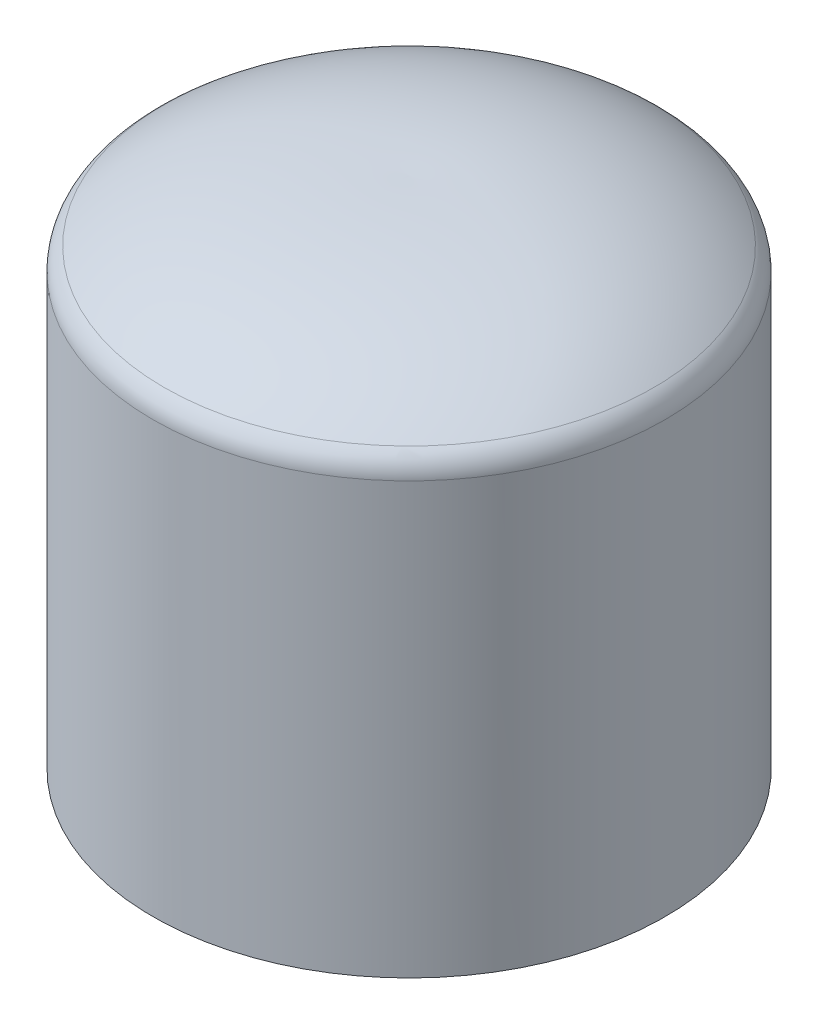
from build123d import *

# Parameters (mm, degrees)
FILLET1_R = 0.508
FILLET2_R = 1.524


with BuildPart() as part:
    # Sketch1 → Revolve1 (revolve)
    with BuildSketch(Plane(origin=(0, 0, 0), x_dir=(0, 0, -1), z_dir=(1, 0, 0)), mode=Mode.PRIVATE) as revolve1_sk:
        with BuildLine():
            Line((-10.7442, 22.410197806), (-10.7442, 0))
            Line((-10.7442, 0), (-13.9192, 0))
            Line((-13.9192, 0), (-13.9192, 24.13))
            add(Edge.make_bspline(
                [(-13.9192, 24.13), (-10.066559664, 27.411628122), (-4.86398701, 28.085571939), (0, 27.94)],
                knots=[0, 0, 0, 0, 1, 1, 1, 1], degree=3))
            Line((0, 27.94), (0, 25.475077416))
            add(Edge.make_bspline(
                [(-10.343014188, 23.11581757), (-7.133322616, 24.732985356), (-3.68565122, 25.519405304), (0, 25.475077416)],
                knots=[0.040116886, 0.040116886, 0.040116886, 0.040116886, 1, 1, 1, 1], degree=3))
            Line((-10.343014188, 23.11581757), (-10.343014188, 22.410197806))
            Line((-10.343014188, 22.410197806), (-10.7442, 22.410197806))
        make_face()
    revolve(revolve1_sk.sketch.rotate(Axis((0, 0, 0), (0, 1, 0)), 180), axis=Axis((0, 0, 0), (0, 1, 0)))

    # Fillet1
    fillet1_edges = [part.edges().sort_by_distance(p)[0] for p in [
        (0, 0, 10.7442),
    ]]
    fillet(fillet1_edges, radius=FILLET1_R)

    # Fillet2
    fillet2_edges = [part.edges().sort_by_distance(p)[0] for p in [
        (0, 24.13, 13.9192),
    ]]
    fillet(fillet2_edges, radius=FILLET2_R)


solid = part.part
